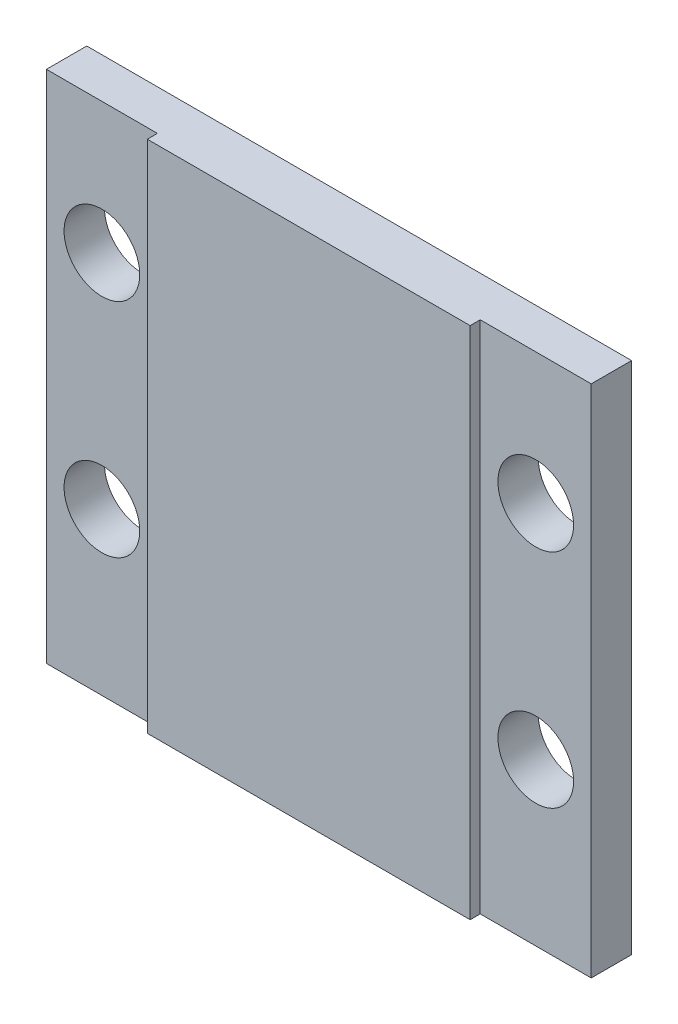
from build123d import *

# Parameters (mm, degrees)
CROQUIS1_W              = 54
CROQUIS1_H              = 51
CROQUIS1_R              = 3.75
SALIENTE_EXTRUIR1_DEPTH = 4
CROQUIS2_W              = 32
CROQUIS2_H              = 51
SALIENTE_EXTRUIR2_DEPTH = 1


with BuildPart() as part:
    # Croquis1 → Saliente-Extruir1 (new body)
    with BuildSketch(Plane.XY):
        Rectangle(CROQUIS1_W, CROQUIS1_H)
        with Locations((-21.5, 12.5)):
            Circle(CROQUIS1_R, mode=Mode.SUBTRACT)
        with Locations((21.5, 12.5)):
            Circle(CROQUIS1_R, mode=Mode.SUBTRACT)
        with Locations((21.5, -9.5)):
            Circle(CROQUIS1_R, mode=Mode.SUBTRACT)
        with Locations((-21.5, -9.5)):
            Circle(CROQUIS1_R, mode=Mode.SUBTRACT)
    extrude(amount=-SALIENTE_EXTRUIR1_DEPTH)

    # Croquis2 → Saliente-Extruir2 (add)
    with BuildSketch(Plane.XY):
        Rectangle(CROQUIS2_W, CROQUIS2_H)
    extrude(amount=SALIENTE_EXTRUIR2_DEPTH)


solid = part.part
